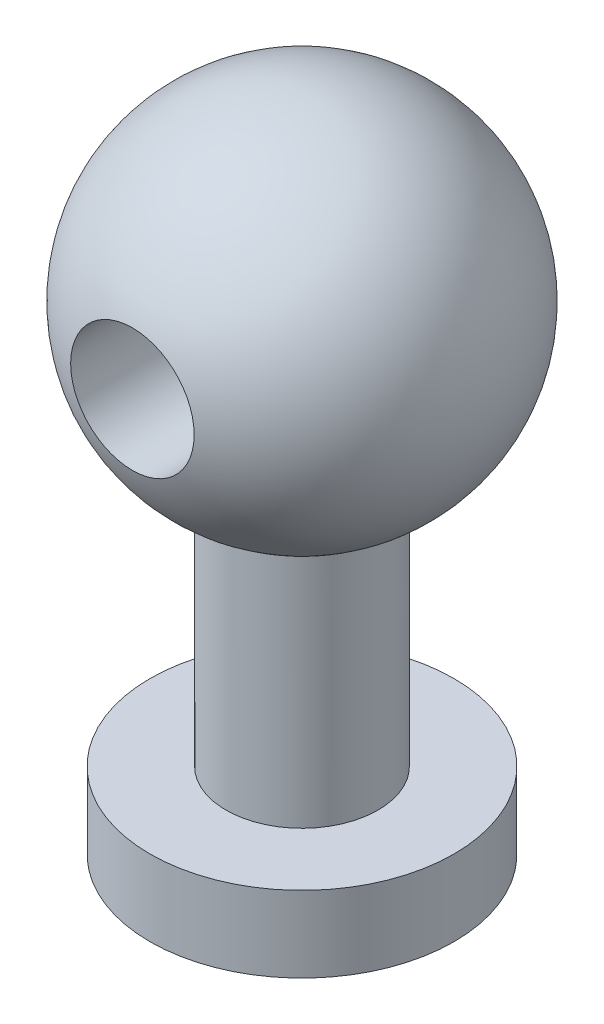
from build123d import *

# Parameters (mm, degrees)
SKETCH2_R          = 3.25
CUT_EXTRUDE1_DEPTH = 20


with BuildPart() as part:
    # Sketch1 → Revolve1 (revolve)
    with BuildSketch(Plane.XY, mode=Mode.PRIVATE) as revolve1_sk:
        with BuildLine():
            Line((0, 0), (8, 0))
            Line((8, 0), (8, 4))
            Line((8, 4), (4, 4))
            Line((4, 4), (4, 16.58315603))
            ThreePointArc((4, 16.58315603), (9.2765839, 27.248167753), (0, 34.7))
            Line((0, 34.7), (0, 0))
        make_face()
    revolve(revolve1_sk.sketch.rotate(Axis((0, 0, 0), (0, 1, 0)), 90), axis=Axis((0, 0, 0), (0, 1, 0)))

    # Sketch2 → Cut-Extrude1 (cut, symmetric)
    with BuildSketch(Plane.XY):
        with Locations((0, 25.2)):
            Circle(SKETCH2_R)
    extrude(amount=CUT_EXTRUDE1_DEPTH, both=True, mode=Mode.SUBTRACT)


solid = part.part
